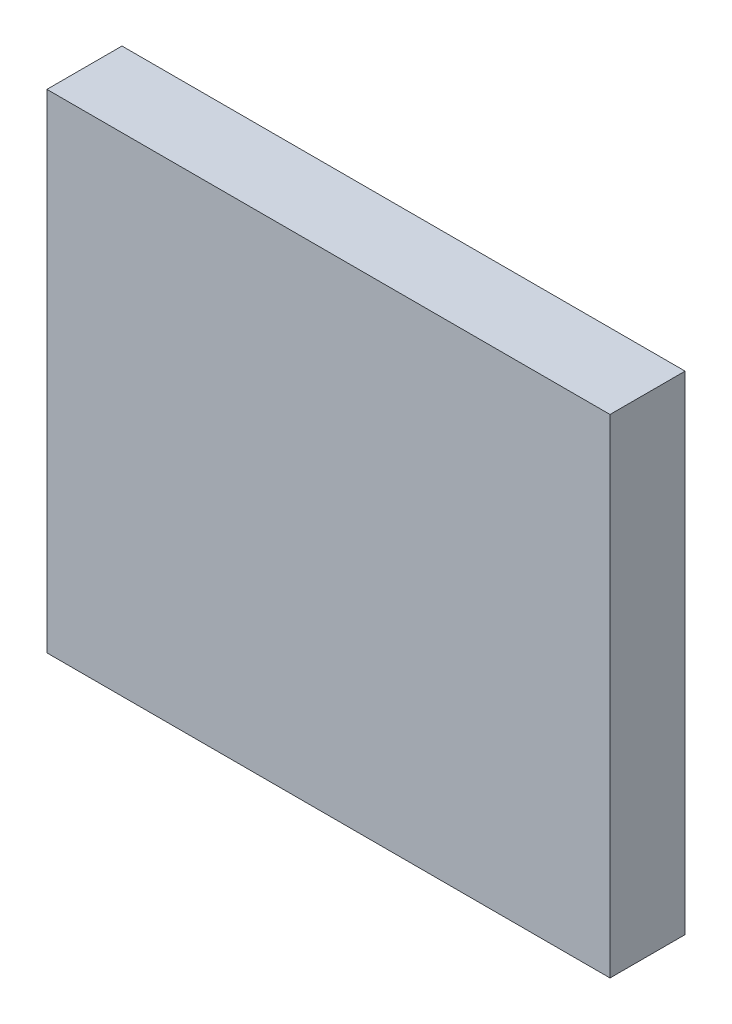
from build123d import *

# Parameters (mm, degrees)
ESQUISSE1_W        = 95.25
ESQUISSE1_H        = 82.55
BOSS_EXTRU_1_DEPTH = 12.7


with BuildPart() as part:
    # Esquisse1 → Boss.-Extru.1 (new body)
    with BuildSketch(Plane.XY):
        Rectangle(ESQUISSE1_W, ESQUISSE1_H)
    extrude(amount=BOSS_EXTRU_1_DEPTH)


solid = part.part
